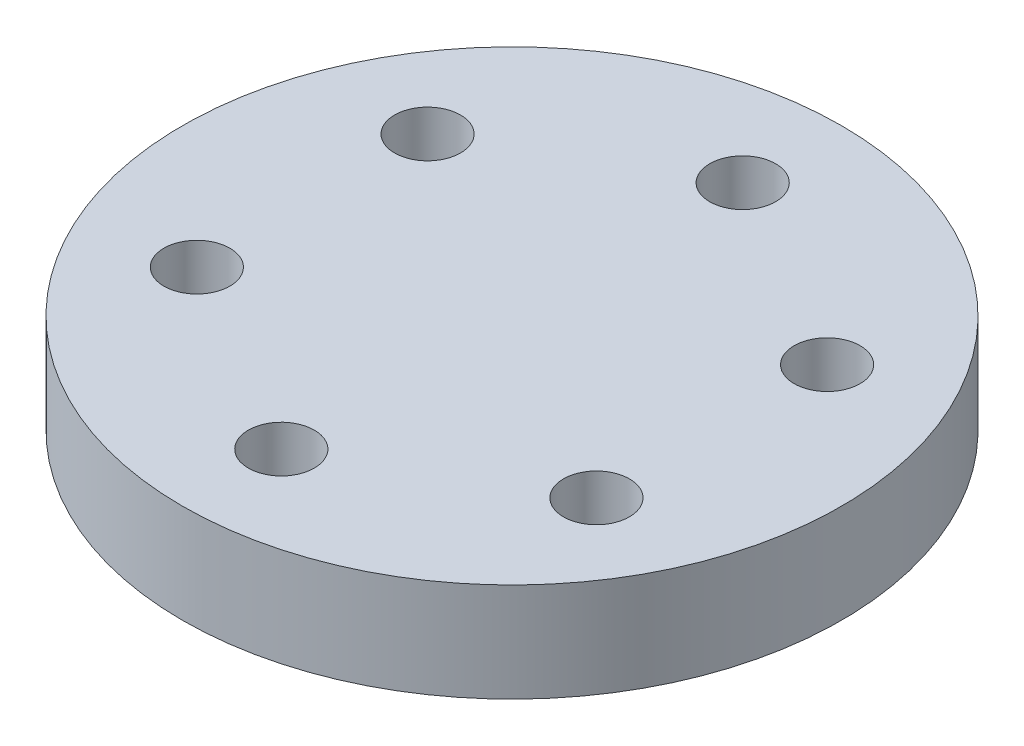
from build123d import *

# Parameters (mm, degrees)
SKETCH1_R           = 50
BOSS_EXTRUDE1_DEPTH = 15
SKETCH2_R           = 5
CUT_EXTRUDE2_DEPTH  = 73.284161474
CIRPATTERN1_COUNT   = 6


with BuildPart() as part:
    # Sketch1 → Boss-Extrude1 (new body)
    with BuildSketch(Plane(origin=(0, 0, 0), x_dir=(1, 0, 0), z_dir=(0, 1, 0))):
        with Locations(Location((0, 0, 0), (0, 0, 270))):
            Circle(SKETCH1_R)
    extrude(amount=BOSS_EXTRUDE1_DEPTH)

    # Sketch2 → Cut-Extrude2 (cut, through all)
    with BuildSketch(Plane(origin=(0, 15, 0), x_dir=(1, 0, 0), z_dir=(0, 1, 0))):
        with Locations(Location((0, 35, 0), (0, 0, 270))):
            Circle(SKETCH2_R)
    cut_extrude2 = extrude(amount=-CUT_EXTRUDE2_DEPTH, mode=Mode.SUBTRACT)

    # CirPattern1: Cut-Extrude2 ×6 about axis
    cirpattern1_axis = Axis((0, 0, 0), (0, 1, 0))
    for i in range(1, CIRPATTERN1_COUNT):
        add(cut_extrude2.rotate(cirpattern1_axis, i * 360 / CIRPATTERN1_COUNT), mode=Mode.SUBTRACT)


solid = part.part
